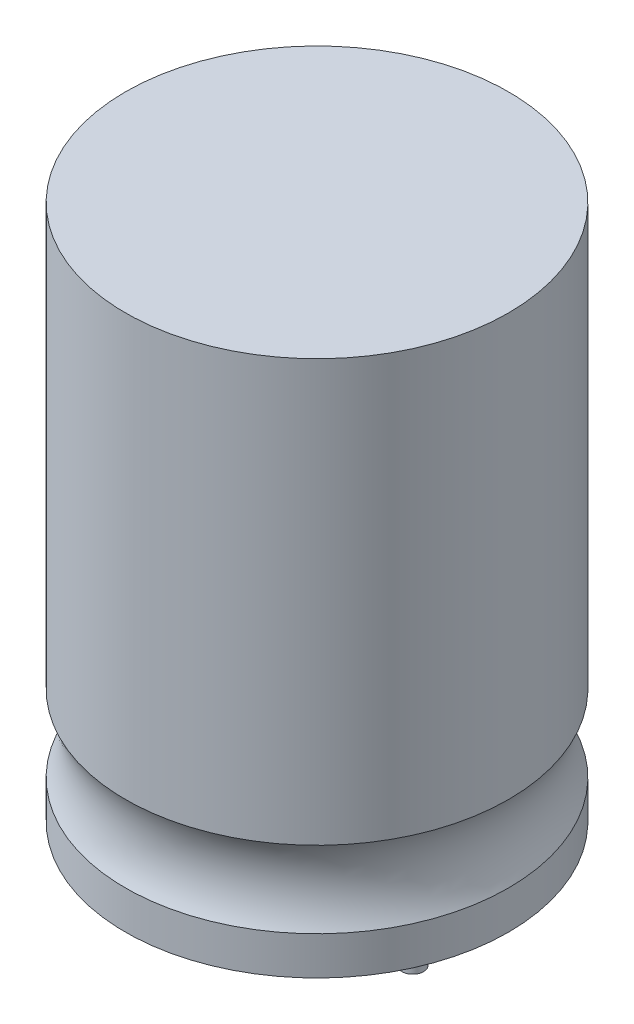
from build123d import *

# Parameters (mm, degrees)
SKETCH2_R           = 0.282946128
BOSS_EXTRUDE1_DEPTH = 2


with BuildPart() as part:
    # Sketch1 → Revolve1 (revolve)
    with BuildSketch(Plane.XY, mode=Mode.PRIVATE) as revolve1_sk:
        with BuildLine():
            Line((0, 14), (0, 0))
            Line((0, 0), (5, 0))
            Line((5, 0), (5, 1))
            ThreePointArc((5, 1), (4.732050808, 2), (5, 3))
            Line((5, 3), (5, 14))
            Line((5, 14), (0, 14))
        make_face()
    revolve(revolve1_sk.sketch.rotate(Axis((0, 14, 0), (0, -1, 0)), 180), axis=Axis((0, 14, 0), (0, -1, 0)))

    # Sketch2 → Boss-Extrude1 (add)
    with BuildSketch(Plane.XZ):
        with Locations(Location((2.5, 0, 0), (0, 0, 180))):
            Circle(SKETCH2_R)
        with Locations(Location((-2.5, 0, 0), (0, 0, 180))):
            Circle(SKETCH2_R)
    extrude(amount=BOSS_EXTRUDE1_DEPTH)


solid = part.part
